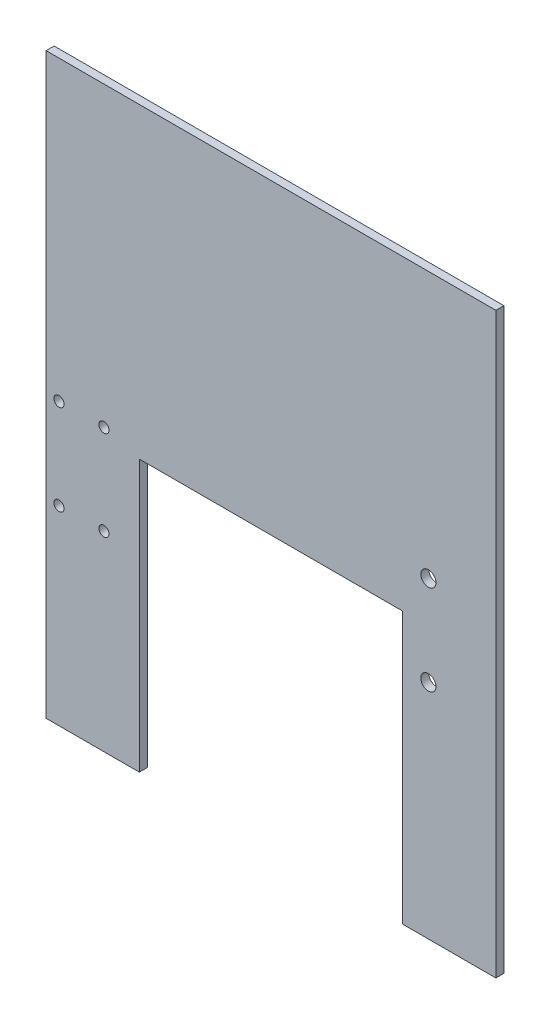
from build123d import *

# Parameters (mm, degrees)
BOSS_EXTRUDE1_DEPTH = 3.175
SKETCH2_R           = 2
CUT_EXTRUDE1_DEPTH  = 3.175
SKETCH3_R           = 3
CUT_EXTRUDE2_DEPTH  = 5.08


with BuildPart() as part:
    # Sketch1 → Boss-Extrude1 (new body)
    with BuildSketch(Plane.XY):
        Polygon((0, 0), (0, 228.6), (177.8, 228.6), (177.8, 0), (140.97, 0), (140.97, 107.188), (36.83, 107.188), (36.83, 0), align=None)
    extrude(amount=BOSS_EXTRUDE1_DEPTH)

    # Sketch2 → Cut-Extrude1 (cut)
    with BuildSketch(Plane(origin=(0, 0, 0), x_dir=(-1, 0, 0), z_dir=(0, 0, -1))):
        with Locations((-22.86, 111.071616712)):
            Circle(SKETCH2_R)
        with Locations((-5.080886425, 111.071616712)):
            Circle(SKETCH2_R)
        with Locations((-22.86, 75.511616712)):
            Circle(SKETCH2_R)
        with Locations((-5.080886425, 75.334076645)):
            Circle(SKETCH2_R)
    extrude(amount=-CUT_EXTRUDE1_DEPTH, mode=Mode.SUBTRACT)

    # Sketch3 → Cut-Extrude2 (cut)
    with BuildSketch(Plane(origin=(0, 0, 0), x_dir=(-1, 0, 0), z_dir=(0, 0, -1))):
        with Locations((-151.12245979, 123.444)):
            Circle(SKETCH3_R)
        with Locations((-151.12245979, 87.884)):
            Circle(SKETCH3_R)
    extrude(amount=-CUT_EXTRUDE2_DEPTH, mode=Mode.SUBTRACT)


solid = part.part
